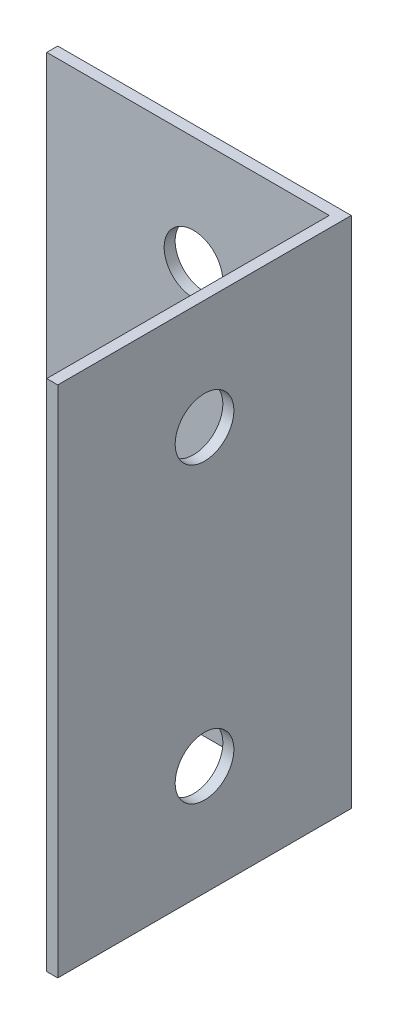
from build123d import *

# Parameters (mm, degrees)
SZKIC1_W                    = 40
SZKIC1_H                    = 70
DODANIE_WYCI_GNI_CIE1_DEPTH = 40
SZKIC2_W                    = 38.5
SZKIC2_H                    = 38.5
WYTNIJ_WYCI_GNI_CIE1_DEPTH  = 80
SZKIC3_R                    = 4
WYTNIJ_WYCI_GNI_CIE2_DEPTH  = 80
SZKIC11_R                   = 4
WYTNIJ_WYCI_GNI_CIE3_DEPTH  = 40


with BuildPart() as part:
    # Szkic1 → Dodanie-wyciągnięcie1 (new body)
    with BuildSketch(Plane.XY):
        Rectangle(SZKIC1_W, SZKIC1_H)
    extrude(amount=DODANIE_WYCI_GNI_CIE1_DEPTH)

    # Szkic2 → Wytnij-wyciągnięcie1 (cut)
    with BuildSketch(Plane(origin=(0, 35, 0), x_dir=(1, 0, 0), z_dir=(0, 1, 0))):
        with Locations((-0.75, -20.75)):
            Rectangle(SZKIC2_W, SZKIC2_H)
    extrude(amount=-WYTNIJ_WYCI_GNI_CIE1_DEPTH, mode=Mode.SUBTRACT)

    # Szkic3 → Wytnij-wyciągnięcie2 (cut)
    with BuildSketch(Plane.ZY.offset(-18.5)):
        with Locations(Location((20, 20, 0), (0, 0, 270))):
            Circle(SZKIC3_R)
        with Locations((20, -20)):
            Circle(SZKIC3_R)
    extrude(amount=-WYTNIJ_WYCI_GNI_CIE2_DEPTH, mode=Mode.SUBTRACT)

    # Szkic11 → Wytnij-wyciągnięcie3 (cut)
    with BuildSketch(Plane.XY.offset(1.5)):
        with Locations((0, 20)):
            Circle(SZKIC11_R)
        with Locations((0, -20)):
            Circle(SZKIC11_R)
    extrude(amount=-WYTNIJ_WYCI_GNI_CIE3_DEPTH, mode=Mode.SUBTRACT)


solid = part.part
